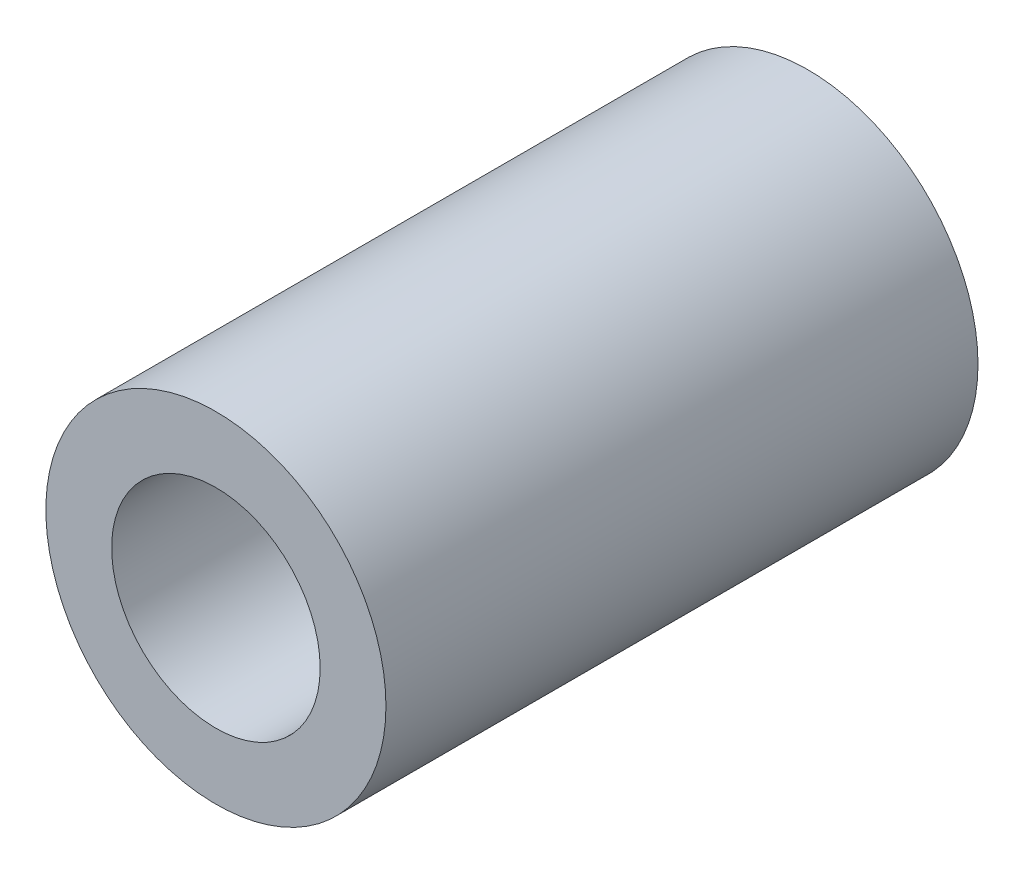
from build123d import *

# Parameters (mm, degrees)
SKETCH_1_R      = 2.585
SKETCH_1_R_2    = 1.585
EXTRUDE_1_DEPTH = 9


with BuildPart() as part:
    # 草图1 → 凸台-拉伸1 (new body)
    with BuildSketch(Plane.XY):
        Circle(SKETCH_1_R)
        Circle(SKETCH_1_R_2, mode=Mode.SUBTRACT)
    extrude(amount=EXTRUDE_1_DEPTH)


solid = part.part
